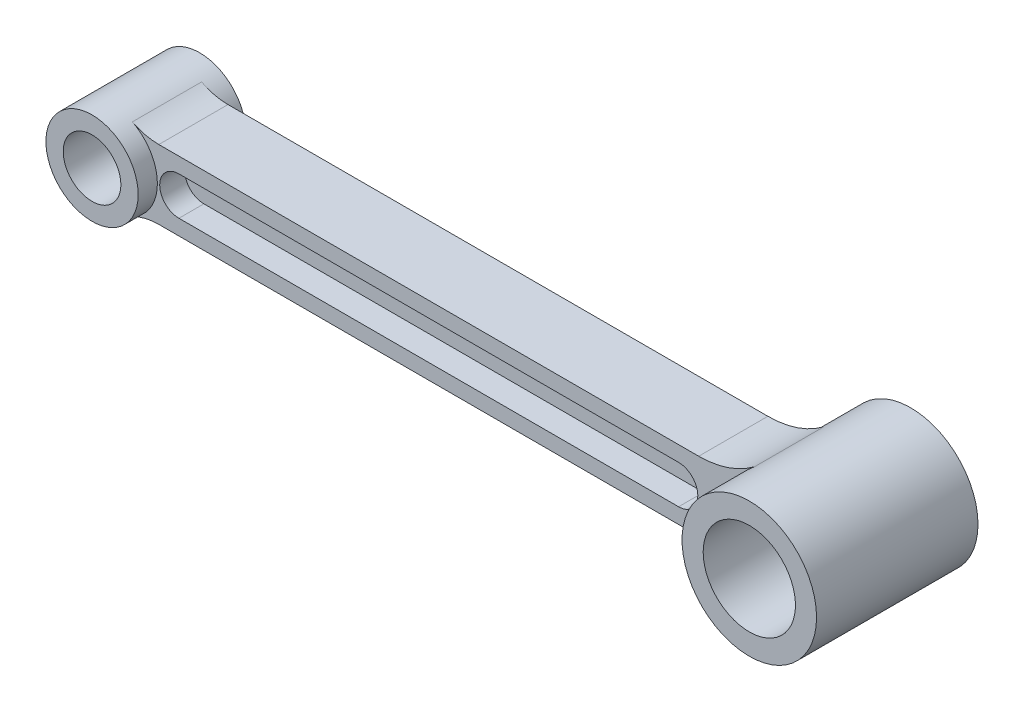
from build123d import *

# Parameters (mm, degrees)
SKETCH1_R           = 7.5
BOSS_EXTRUDE2_DEPTH = 14
SKETCH1_7_R         = 17.5
SKETCH1_7_R_2       = 12
BOSS_EXTRUDE3_DEPTH = 21
BOSS_EXTRUDE4_DEPTH = 9
CUT_EXTRUDE1_START  = 2.5
CUT_EXTRUDE1_DEPTH  = 18


with BuildPart() as part:
    # Sketch1 → Boss-Extrude2 (new, symmetric)
    with BuildSketch(Plane.XY):
        with BuildLine():
            ThreePointArc((-34.108763921, 0), (-35.86255267, 6.246211251), (-40.611289754, 10.666666667))
            ThreePointArc((-40.611289754, 10.666666667), (-58.108763921, 0), (-40.611289754, -10.666666667))
            ThreePointArc((-40.611289754, -10.666666667), (-35.86255267, -6.246211251), (-34.108763921, 0))
        make_face()
        with Locations((-46.108763921, 0)):
            Circle(SKETCH1_R, mode=Mode.SUBTRACT)
    extrude(amount=BOSS_EXTRUDE2_DEPTH, both=True)



with BuildPart() as body_2:
    # Sketch1<7> → Boss-Extrude3 (new, symmetric)
    with BuildSketch(Plane.XY):
        with Locations((131.891236079, 0)):
            Circle(SKETCH1_7_R)
        with Locations((131.891236079, 0)):
            Circle(SKETCH1_7_R_2, mode=Mode.SUBTRACT)
    extrude(amount=BOSS_EXTRUDE3_DEPTH, both=True)


with BuildPart() as part_1:
    add(part.part)

    add(body_2.part)  # Boss-Extrude4 merges body 2
    # Sketch1<11> → Boss-Extrude4 (add, symmetric)
    with BuildSketch(Plane.XY):
        with BuildLine():
            ThreePointArc((-40.611289754, 10.666666667), (-34.108763921, 0), (-40.611289754, -10.666666667))
            ThreePointArc((-40.611289754, -10.666666667), (-37.27498095, -9.422620263), (-33.739447044, -9))
            Line((-33.739447044, -9), (106.726777015, -9))
            ThreePointArc((106.726777015, -9), (114.407138452, -10.26210106), (121.279717196, -13.915662651))
            ThreePointArc((121.279717196, -13.915662651), (114.391236079, 0), (121.279717196, 13.915662651))
            ThreePointArc((121.279717196, 13.915662651), (114.407138452, 10.26210106), (106.726777015, 9))
            Line((106.726777015, 9), (-33.739447044, 9))
            ThreePointArc((-33.739447044, 9), (-37.27498095, 9.422620263), (-40.611289754, 10.666666667))
        make_face()
    extrude(amount=BOSS_EXTRUDE4_DEPTH, both=True)

    # Sketch2 → Cut-Extrude1 (cut)
    with BuildSketch(Plane(origin=(0, 0, 0), x_dir=(-1, 0, 0), z_dir=(0, 0, -1)).offset(CUT_EXTRUDE1_START)):
        with BuildLine():
            Line((-101.493664985, 5), (28.506335015, 5))
            ThreePointArc((28.506335015, 5), (33.506335015, 0), (28.506335015, -5))
            Line((28.506335015, -5), (-101.493664985, -5))
            ThreePointArc((-101.493664985, -5), (-106.493664985, 0), (-101.493664985, 5))
        make_face()
    cut_extrude1 = extrude(amount=CUT_EXTRUDE1_DEPTH, mode=Mode.SUBTRACT)

    # Mirror1: Cut-Extrude1 across plane
    add(cut_extrude1.mirror(Plane(origin=(0, 0, 0), x_dir=(1, 0, 0), z_dir=(0, 0, -1))), mode=Mode.SUBTRACT)


solid = part_1.part
